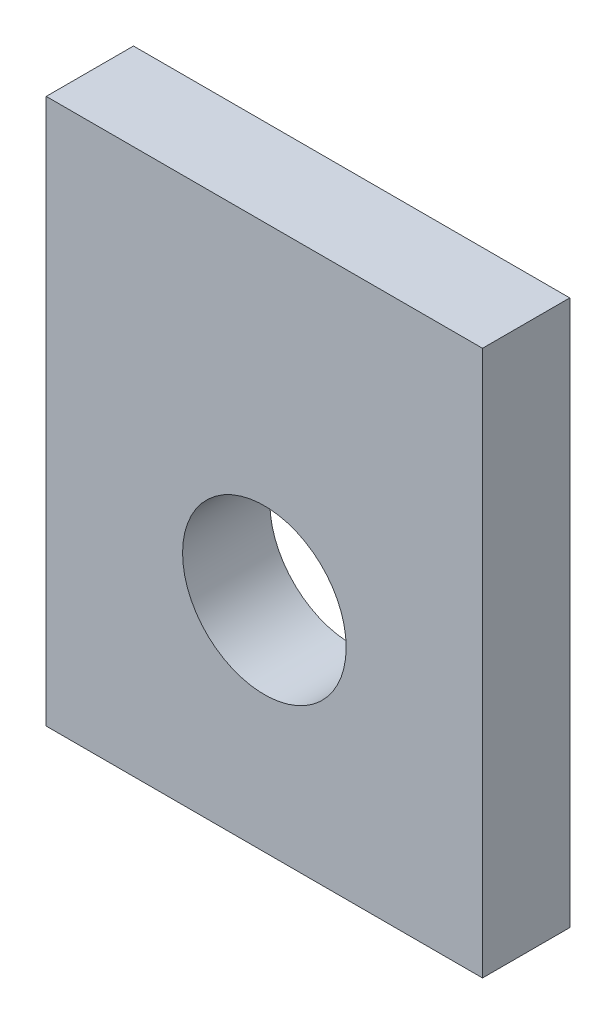
from build123d import *

# Parameters (mm, degrees)
SKETCH1_W           = 40
SKETCH1_H           = 50
SKETCH1_R           = 7.5
BOSS_EXTRUDE1_DEPTH = 8


with BuildPart() as part:
    # Sketch1 → Boss-Extrude1 (new body)
    with BuildSketch(Plane.XY):
        with Locations((6.727272727, -3.090909091)):
            Rectangle(SKETCH1_W, SKETCH1_H)
        with Locations((6.727272727, -8.090909091)):
            Circle(SKETCH1_R, mode=Mode.SUBTRACT)
    extrude(amount=BOSS_EXTRUDE1_DEPTH)


solid = part.part
